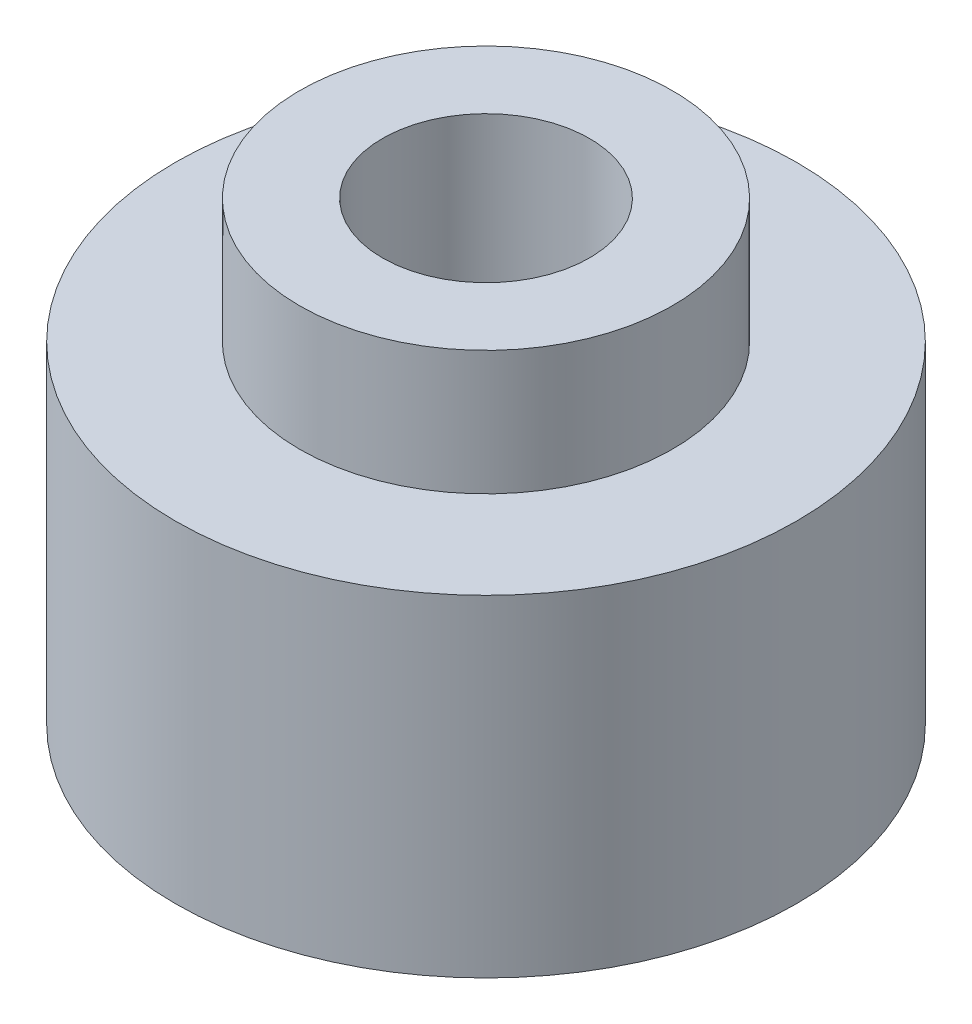
from build123d import *

# Parameters (mm, degrees)
SKETCH1_R           = 7.5
BOSS_EXTRUDE1_DEPTH = 11
SKETCH2_R           = 2.5
CUT_EXTRUDE1_DEPTH  = 16.28070679
CUT_EXTRUDE3_START  = -3
SKETCH3_R           = 7.5
SKETCH3_R_2         = 4.5
CUT_EXTRUDE3_DEPTH  = 3


with BuildPart() as part:
    # Sketch1 → Boss-Extrude1 (new body)
    with BuildSketch(Plane(origin=(0, 0, 0), x_dir=(1, 0, 0), z_dir=(0, 1, 0))):
        with Locations(Location((0, 0, 0), (0, 0, 270))):
            Circle(SKETCH1_R)
    extrude(amount=BOSS_EXTRUDE1_DEPTH)

    # Sketch2 → Cut-Extrude1 (cut, through all)
    with BuildSketch(Plane(origin=(0, 11, 0), x_dir=(1, 0, 0), z_dir=(0, 1, 0))):
        with Locations(Location((0, 0, 0), (0, 0, 270))):
            Circle(SKETCH2_R)
    extrude(amount=-CUT_EXTRUDE1_DEPTH, mode=Mode.SUBTRACT)

    # Sketch3 → Cut-Extrude3 (cut)
    with BuildSketch(Plane(origin=(0, 11, 0), x_dir=(1, 0, 0), z_dir=(0, 1, 0)).offset(CUT_EXTRUDE3_START)):
        with Locations(Location((0, 0, 0), (0, 0, 270))):
            Circle(SKETCH3_R)
        with Locations(Location((0, 0, 0), (0, 0, 270))):
            Circle(SKETCH3_R_2, mode=Mode.SUBTRACT)
    extrude(amount=CUT_EXTRUDE3_DEPTH, mode=Mode.SUBTRACT)


solid = part.part
